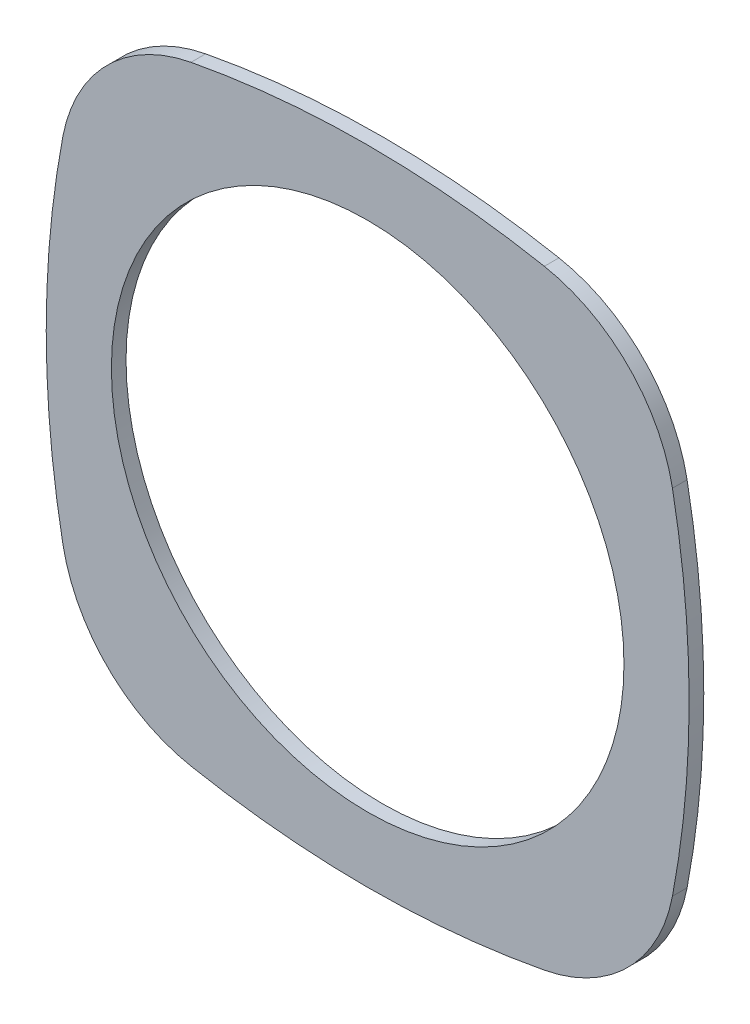
from build123d import *

# Parameters (mm, degrees)
SKETCH1_R           = 17.5
BOSS_EXTRUDE1_DEPTH = 1


with BuildPart() as part:
    # Sketch1 → Boss-Extrude1 (new body)
    with BuildSketch(Plane.XY):
        with BuildLine():
            ThreePointArc((12.063833391, 20.811277708), (0, 21.95), (-12.063833391, 20.811277708))
            ThreePointArc((-12.063833391, 20.811277708), (-17.783735547, 17.783735547), (-20.811277708, 12.063833391))
            ThreePointArc((-20.811277708, 12.063833391), (-21.95, 0), (-20.811277708, -12.063833391))
            ThreePointArc((-20.811277708, -12.063833391), (-17.783735547, -17.783735547), (-12.063833391, -20.811277708))
            ThreePointArc((-12.063833391, -20.811277708), (0, -21.95), (12.063833391, -20.811277708))
            ThreePointArc((12.063833391, -20.811277708), (17.783735547, -17.783735547), (20.811277708, -12.063833391))
            ThreePointArc((20.811277708, -12.063833391), (21.95, 0), (20.811277708, 12.063833391))
            ThreePointArc((20.811277708, 12.063833391), (17.783735547, 17.783735547), (12.063833391, 20.811277708))
        make_face()
        Circle(SKETCH1_R, mode=Mode.SUBTRACT)
    extrude(amount=BOSS_EXTRUDE1_DEPTH)


solid = part.part
